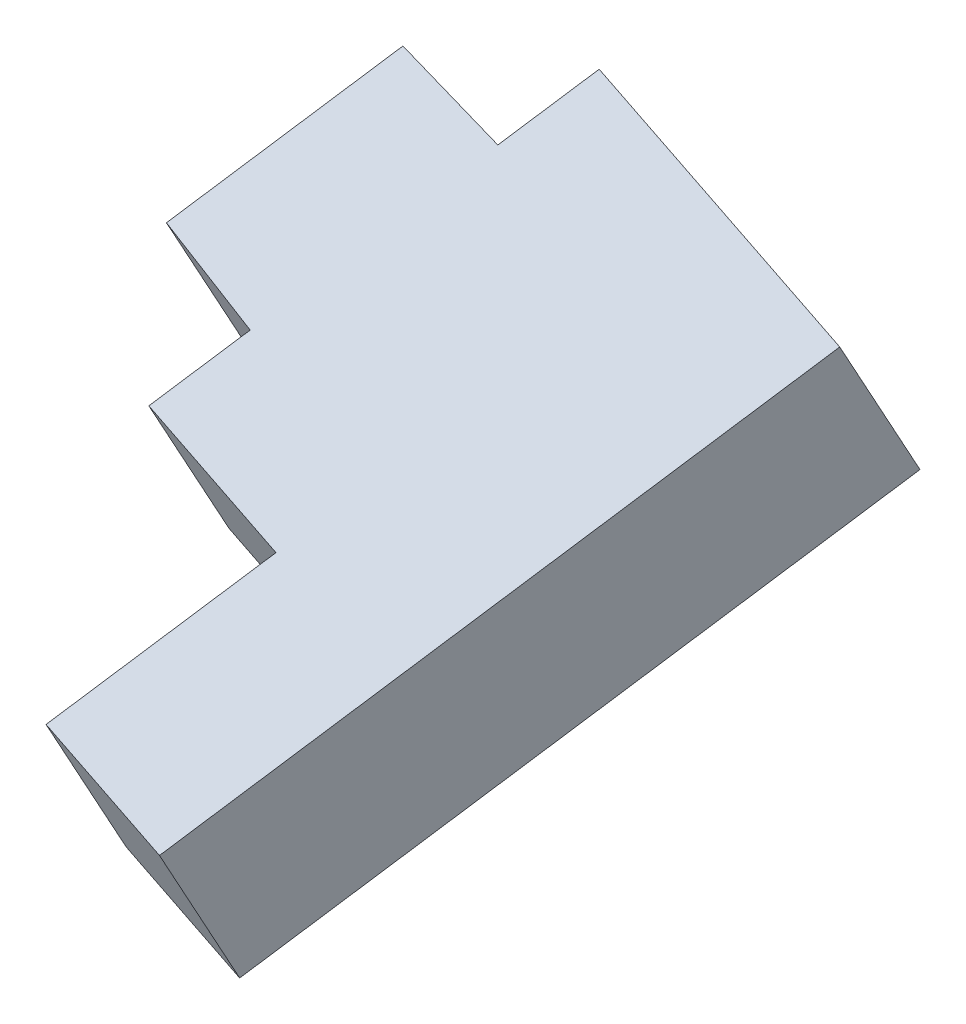
from build123d import *

# Parameters (mm, degrees)
BOSS_EXTRUDE1_DEPTH = 3


with BuildPart() as part:
    # Sketch1 → Boss-Extrude1 (new, symmetric)
    with BuildSketch(Plane(origin=(-30.283899698, 190.565141588, 90.851699095), x_dir=(0.9895658040523138, 0.13875740324000216, 0.038805959547332534), z_dir=(-0.1419946168296557, 0.8935184877292665, 0.4259838504889642))):
        Polygon((6.324969733, 177.066470322), (8.995614558, 185.285829771), (0.873595698, 187.924846566), (2.050955651, 191.548370203), (-3.590633831, 193.601750023), (-0.843460609, 202.056638508), (4.92762278, 200.401798006), (6.104982732, 204.025321642), (21.474048864, 199.031584942), (13.572017005, 174.711750418), align=None)
    extrude(amount=BOSS_EXTRUDE1_DEPTH, both=True)


solid = part.part
